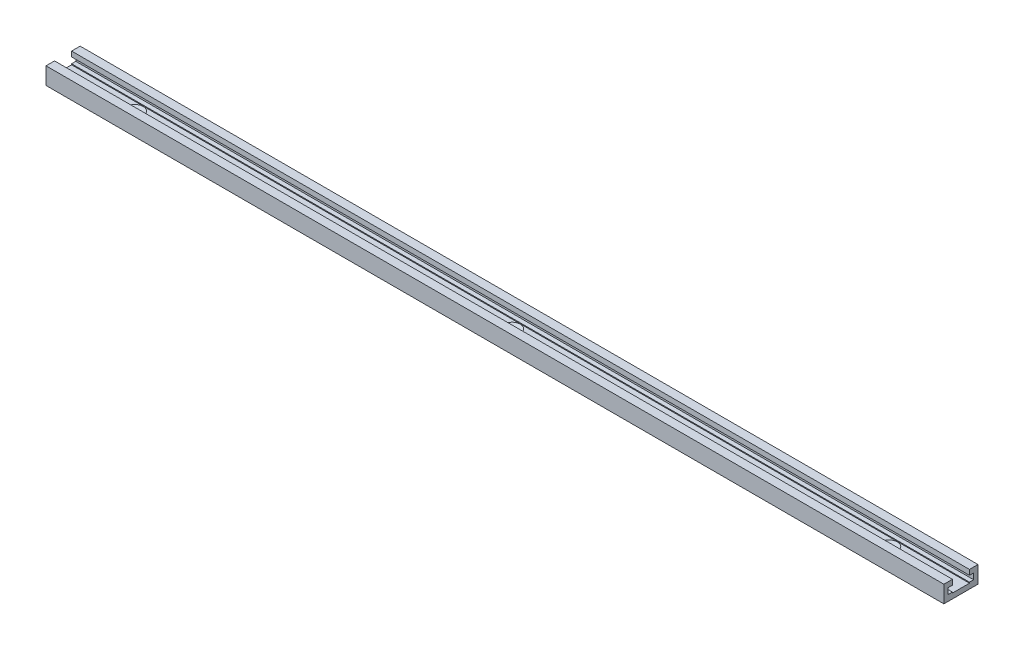
from build123d import *

# Parameters (mm, degrees)
BOSS_EXTRUDE1_DEPTH                                  = 250
CSK_FOR_M4_HEX_SOCKET_COUNTERSUNK_HEAD_S_D           = 4.5
CSK_FOR_M4_HEX_SOCKET_COUNTERSUNK_HEAD_S_DEPTH       = 5.4
CSK_FOR_M4_HEX_SOCKET_COUNTERSUNK_HEAD_S_CSINK_D     = 9.18
CSK_FOR_M4_HEX_SOCKET_COUNTERSUNK_HEAD_S_CSINK_ANGLE = 90
CSK_FOR_M4_HEX_SOCKET_COUNTERSUNK_HEAD_S_TIP         = 1.351936393


with BuildPart() as part:
    # Sketch1 → Boss-Extrude1 (new, symmetric)
    with BuildSketch(Plane(origin=(0, 0, 0), x_dir=(0, 0, -1), z_dir=(1, 0, 0))):
        Polygon((-4.75, 4.75), (-9.5, 4.75), (-9.5, -4.75), (9.5, -4.75), (9.5, 4.75), (4.75, 4.75), (4.75, 1.9), (7.1, 1.9), (7.1, -1.4), (4.75, -1.4), (4.75, -1.9), (-4.75, -1.9), (-4.75, -1.4), (-7.1, -1.4), (-7.1, 1.9), (-4.75, 1.9), align=None)
    extrude(amount=BOSS_EXTRUDE1_DEPTH, both=True)

    # CSK for M4 Hex Socket Countersunk Head Screw1
    with Locations(Plane(origin=(0, -1.9, 0), x_dir=(1, 0, 0), z_dir=(0, 1, 0))):
        with Locations((0, 0), (-210, 0), (210, 0)):
            CounterSinkHole(CSK_FOR_M4_HEX_SOCKET_COUNTERSUNK_HEAD_S_D / 2, CSK_FOR_M4_HEX_SOCKET_COUNTERSUNK_HEAD_S_CSINK_D / 2, depth=CSK_FOR_M4_HEX_SOCKET_COUNTERSUNK_HEAD_S_DEPTH, counter_sink_angle=CSK_FOR_M4_HEX_SOCKET_COUNTERSUNK_HEAD_S_CSINK_ANGLE)
            with Locations((0, 0, -(CSK_FOR_M4_HEX_SOCKET_COUNTERSUNK_HEAD_S_DEPTH + CSK_FOR_M4_HEX_SOCKET_COUNTERSUNK_HEAD_S_TIP / 2))):  # 118° drill point
                Cone(0, CSK_FOR_M4_HEX_SOCKET_COUNTERSUNK_HEAD_S_D / 2, CSK_FOR_M4_HEX_SOCKET_COUNTERSUNK_HEAD_S_TIP, mode=Mode.SUBTRACT)


solid = part.part
